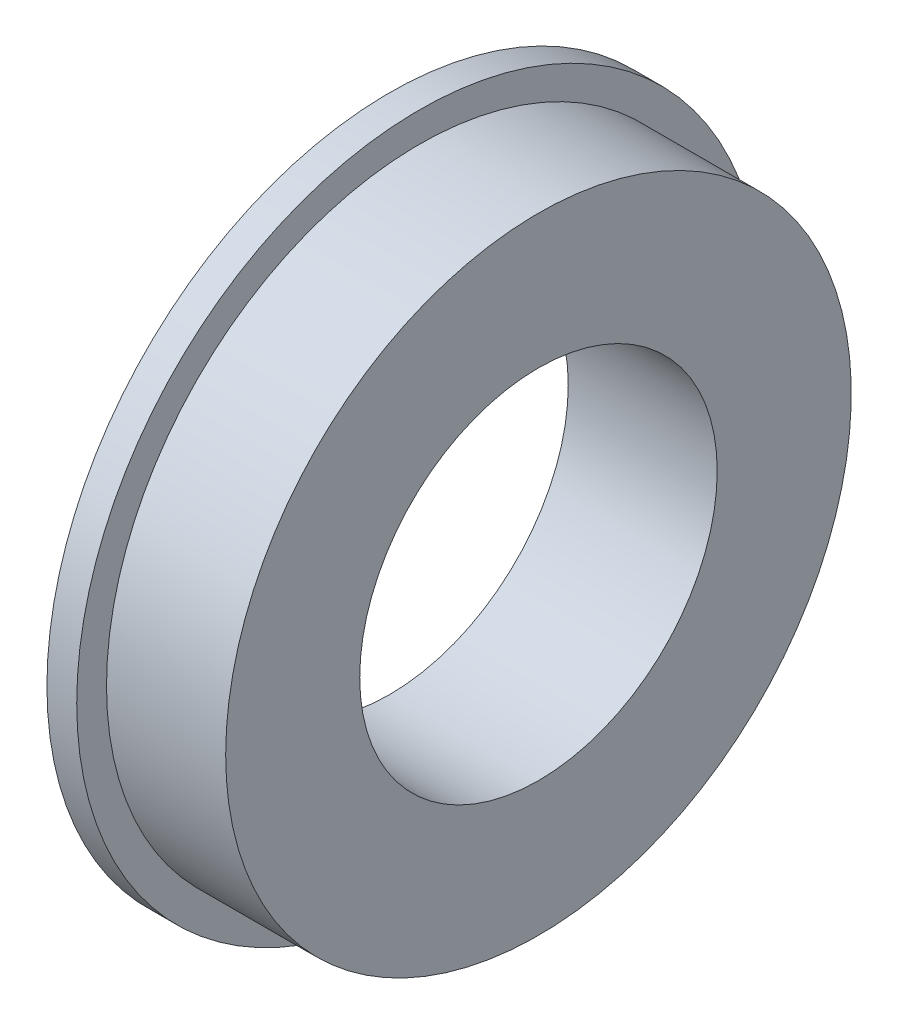
from build123d import *


with BuildPart() as part:
    # 草图1 → 旋转1 (revolve)
    with BuildSketch(Plane.XY, mode=Mode.PRIVATE) as revolve_1_sk:
        Polygon((0, 6), (-5, 6), (-5, 11.5), (-4, 11.5), (-4, 10.5), (0, 10.5), align=None)
    revolve(revolve_1_sk.sketch.rotate(Axis((-18.495412844, 0, 0), (1, 0, 0)), 90), axis=Axis((-18.495412844, 0, 0), (1, 0, 0)))


solid = part.part
